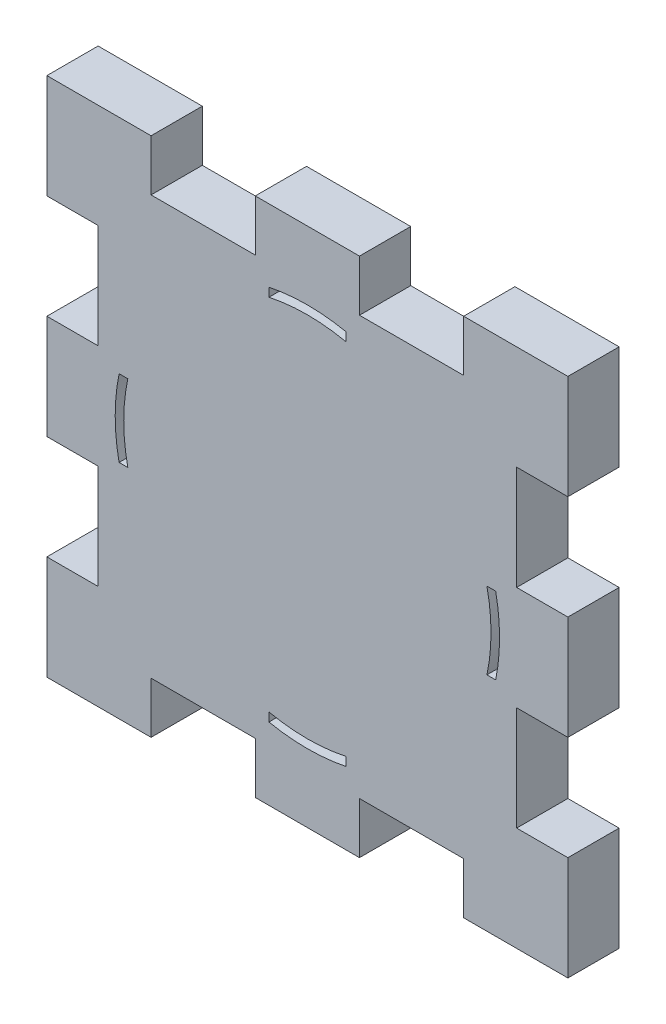
from build123d import *

# Parameters (mm, degrees)
SKETCH1_W           = 154.94
SKETCH1_H           = 154.94
BOSS_EXTRUDE1_DEPTH = 15.24
SKETCH3_W           = 15.24
SKETCH3_H           = 30.988
SKETCH3_W_2         = 30.988
SKETCH3_H_2         = 15.24
CUT_EXTRUDE1_DEPTH  = 220.647592293
CUT_EXTRUDE2_DEPTH  = 220.647592293


with BuildPart() as part:
    # Sketch1 → Boss-Extrude1 (new body)
    with BuildSketch(Plane.XY):
        with Locations((77.47, 77.47)):
            Rectangle(SKETCH1_W, SKETCH1_H)
    extrude(amount=BOSS_EXTRUDE1_DEPTH)

    # Sketch3 → Cut-Extrude1 (cut, through all)
    with BuildSketch(Plane.XY.offset(15.24)):
        with Locations((7.62, 108.458)):
            Rectangle(SKETCH3_W, SKETCH3_H)
        with Locations((7.62, 46.482)):
            Rectangle(SKETCH3_W, SKETCH3_H)
        with Locations((147.32, 108.458)):
            Rectangle(SKETCH3_W, SKETCH3_H)
        with Locations((147.32, 46.482)):
            Rectangle(SKETCH3_W, SKETCH3_H)
        with Locations((46.482, 147.32)):
            Rectangle(SKETCH3_W_2, SKETCH3_H_2)
        with Locations((108.458, 147.32)):
            Rectangle(SKETCH3_W_2, SKETCH3_H_2)
        with Locations((46.482, 7.62)):
            Rectangle(SKETCH3_W_2, SKETCH3_H_2)
        with Locations((108.458, 7.62)):
            Rectangle(SKETCH3_W_2, SKETCH3_H_2)
    extrude(amount=-CUT_EXTRUDE1_DEPTH, mode=Mode.SUBTRACT)

    # Sketch7 → Cut-Extrude2 (cut, through all)
    with BuildSketch(Plane.XY.offset(15.24)):
        with BuildLine():
            Line((21.47466448, 66.04), (24.069558054, 66.04))
            ThreePointArc((24.069558054, 66.04), (22.86, 77.47), (24.069558054, 88.9))
            Line((24.069558054, 88.9), (21.47466448, 88.9))
            ThreePointArc((21.47466448, 88.9), (20.32, 77.47), (21.47466448, 66.04))
        make_face()
        with BuildLine():
            Line((88.9, 24.069558054), (88.9, 21.47466448))
            ThreePointArc((88.9, 21.47466448), (77.47, 20.32), (66.04, 21.47466448))
            Line((66.04, 21.47466448), (66.04, 24.069558054))
            ThreePointArc((66.04, 24.069558054), (77.47, 22.86), (88.9, 24.069558054))
        make_face()
        with BuildLine():
            Line((130.870441946, 88.9), (133.46533552, 88.9))
            ThreePointArc((133.46533552, 88.9), (134.62, 77.47), (133.46533552, 66.04))
            Line((133.46533552, 66.04), (130.870441946, 66.04))
            ThreePointArc((130.870441946, 66.04), (132.08, 77.47), (130.870441946, 88.9))
        make_face()
        with BuildLine():
            Line((88.9, 133.46533552), (88.9, 130.870441946))
            ThreePointArc((88.9, 130.870441946), (77.47, 132.08), (66.04, 130.870441946))
            Line((66.04, 130.870441946), (66.04, 133.46533552))
            ThreePointArc((66.04, 133.46533552), (77.47, 134.62), (88.9, 133.46533552))
        make_face()
    extrude(amount=-CUT_EXTRUDE2_DEPTH, mode=Mode.SUBTRACT)


solid = part.part
